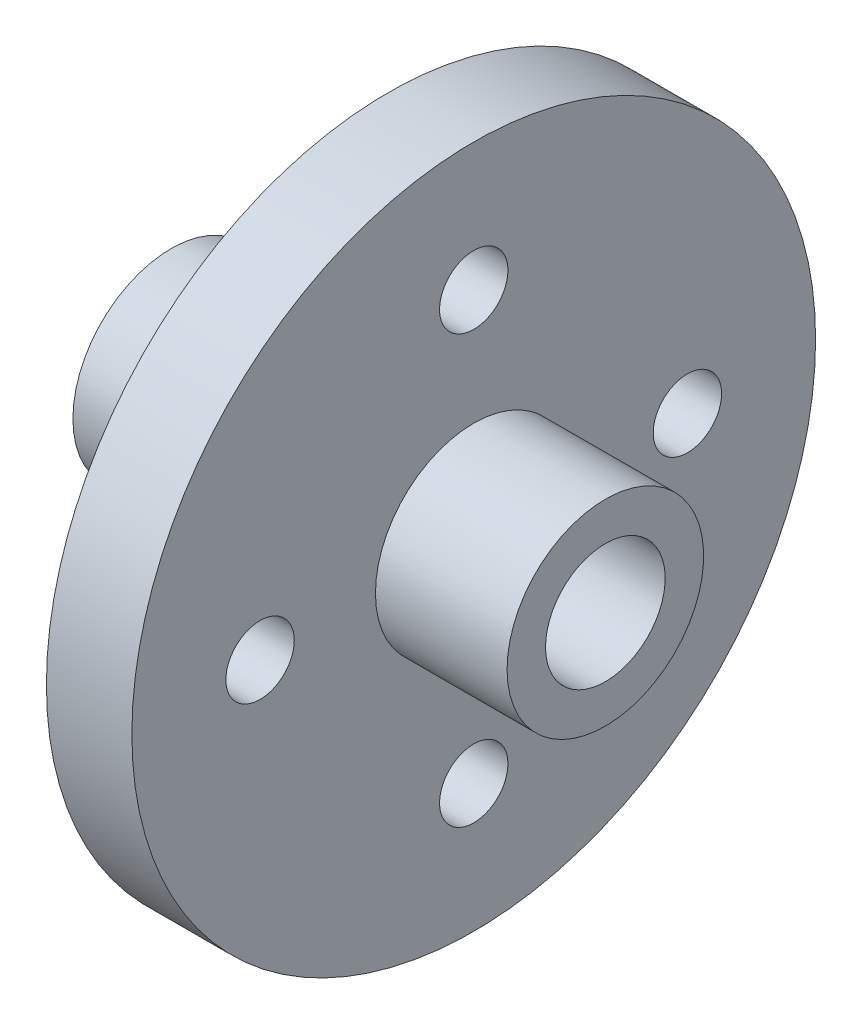
from build123d import *

# Parameters (mm, degrees)
SKETCH1_R                    = 20
SKETCH1_R_2                  = 3.5
BOSS_EXTRUDE1_DEPTH          = 5
BOSS_EXTRUDE2_DEPTH          = 12.7
BOSS_EXTRUDE2_DEPTH_BACK     = 12.7
SKETCH3_R                    = 5.75
SKETCH3_R_2                  = 3.5
F_4_0_4_DIAMETER_HOLE1_D     = 4
F_4_0_4_DIAMETER_HOLE1_DEPTH = 15
F_4_0_4_DIAMETER_HOLE1_TIP   = 1.201721238


with BuildPart() as part:
    # Sketch1 → Boss-Extrude1 (new body)
    with BuildSketch(Plane(origin=(0, 0, 0), x_dir=(0, 0, -1), z_dir=(1, 0, 0))):
        Circle(SKETCH1_R)
        Circle(SKETCH1_R_2, mode=Mode.SUBTRACT)
    extrude(amount=BOSS_EXTRUDE1_DEPTH)

    # Sketch3 → Boss-Extrude2 (add, two sides: drawn at the far end of the back side and taken through both)
    with BuildSketch(Plane.ZY.offset(-BOSS_EXTRUDE2_DEPTH_BACK)):
        Circle(SKETCH3_R)
        Circle(SKETCH3_R_2, mode=Mode.SUBTRACT)
    extrude(amount=BOSS_EXTRUDE2_DEPTH + BOSS_EXTRUDE2_DEPTH_BACK)

    # Ø4.0 (4) Diameter Hole1
    with Locations(Plane(origin=(5, 0, 0), x_dir=(0, 0, -1), z_dir=(1, 0, 0))):
        with Locations((12.5, 0), (0, -12.5), (-12.5, 0), (0, 12.5)):
            Hole(F_4_0_4_DIAMETER_HOLE1_D / 2, depth=F_4_0_4_DIAMETER_HOLE1_DEPTH)
            with Locations((0, 0, -(F_4_0_4_DIAMETER_HOLE1_DEPTH + F_4_0_4_DIAMETER_HOLE1_TIP / 2))):  # 118° drill point
                Cone(0, F_4_0_4_DIAMETER_HOLE1_D / 2, F_4_0_4_DIAMETER_HOLE1_TIP, mode=Mode.SUBTRACT)


solid = part.part
